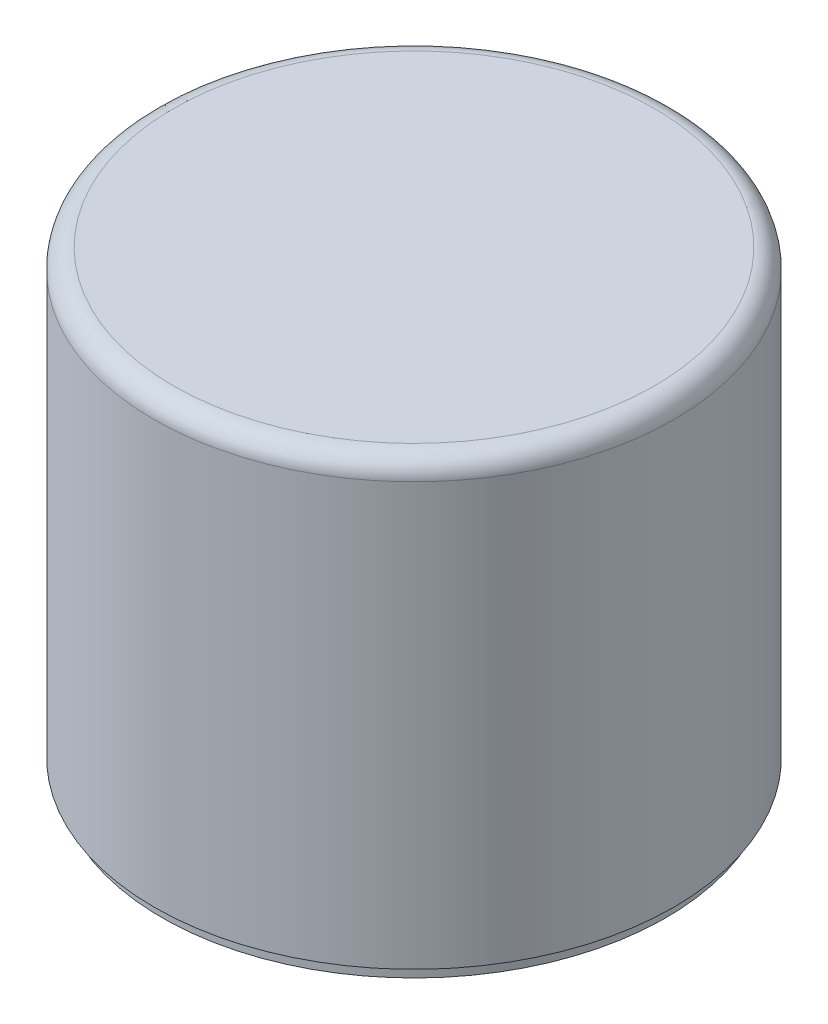
from build123d import *

# Parameters (mm, degrees)
SKETCH1_R           = 40
BOSS_EXTRUDE1_DEPTH = 70
SHELL1_T            = -2
SKETCH2_R           = 40
SKETCH2_R_2         = 38.8
CUT_EXTRUDE1_DEPTH  = 2
FILLET1_R           = 3


with BuildPart() as part:
    # Sketch1 → Boss-Extrude1 (new body)
    with BuildSketch(Plane(origin=(0, 0, 0), x_dir=(1, 0, 0), z_dir=(0, 1, 0))):
        with Locations(Location((0, 0, 0), (0, 0, 270))):
            Circle(SKETCH1_R)
    extrude(amount=BOSS_EXTRUDE1_DEPTH)

    # Shell1
    shell1_openings = [part.faces().sort_by_distance(p)[0] for p in [
        (0, 0, 0),
    ]]
    offset(amount=SHELL1_T, openings=shell1_openings, kind=Kind.INTERSECTION)

    # Sketch2 → Cut-Extrude1 (cut)
    with BuildSketch(Plane.XZ):
        with Locations(Location((0, 0, 0), (0, 0, 270))):
            Circle(SKETCH2_R)
        with Locations(Location((0, 0, 0), (0, 0, 270))):
            Circle(SKETCH2_R_2, mode=Mode.SUBTRACT)
    extrude(amount=-CUT_EXTRUDE1_DEPTH, mode=Mode.SUBTRACT)

    # Fillet1
    fillet1_edges = [part.edges().sort_by_distance(p)[0] for p in [
        (0, 70, -40),
    ]]
    fillet(fillet1_edges, radius=FILLET1_R)


solid = part.part
